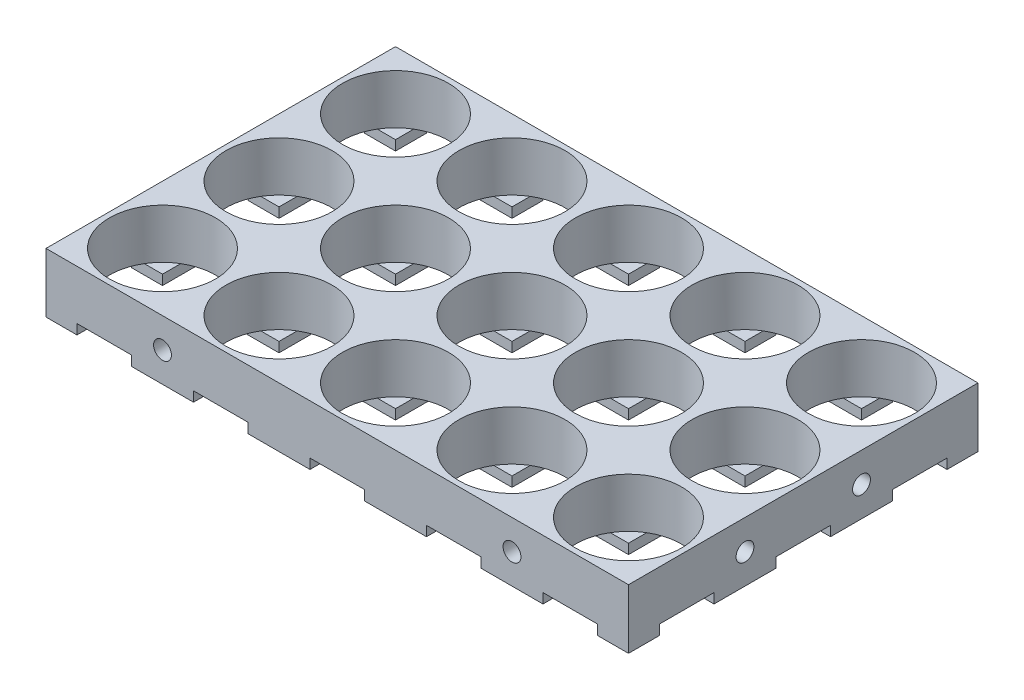
from build123d import *

# Parameters (mm, degrees)
SKETCH1_W           = 23.5
SKETCH1_H           = 23.5
SKETCH1_R           = 10.7
BOSS_EXTRUDE1_DEPTH = 10
SKETCH4_W           = 6.25
SKETCH4_H           = 6.25
BOSS_EXTRUDE2_DEPTH = 2
LPATTERN2_COUNT     = 5
LPATTERN2_PITCH     = 23.5
LPATTERN2_2_COUNT   = 3
LPATTERN2_2_PITCH   = 23.5
SKETCH6_R           = 1.8
CUT_EXTRUDE1_DEPTH  = 6
SKETCH7_R           = 1.8
CUT_EXTRUDE2_DEPTH  = 6
SKETCH8_R           = 1.8
CUT_EXTRUDE3_DEPTH  = 6
SKETCH9_R           = 1.8
CUT_EXTRUDE4_DEPTH  = 6


with BuildPart() as part:
    # Sketch1 → Boss-Extrude1 (new body)
    with BuildSketch(Plane(origin=(0, 0, 0), x_dir=(1, 0, 0), z_dir=(0, 1, 0))):
        Rectangle(SKETCH1_W, SKETCH1_H)
        Circle(SKETCH1_R, mode=Mode.SUBTRACT)
    extrude(amount=BOSS_EXTRUDE1_DEPTH)

    # Sketch4 → Boss-Extrude2 (add)
    with BuildSketch(Plane.XZ):
        with Locations((-8.625, 8.625)):
            Rectangle(SKETCH4_W, SKETCH4_H)
        with Locations((8.625, 8.625)):
            Rectangle(SKETCH4_W, SKETCH4_H)
        with Locations((8.625, -8.625)):
            Rectangle(SKETCH4_W, SKETCH4_H)
        with Locations((-8.625, -8.625)):
            Rectangle(SKETCH4_W, SKETCH4_H)
    extrude(amount=BOSS_EXTRUDE2_DEPTH)


with BuildPart() as lpattern2_1:
    # LPattern2: pattern copy
    add(part.part.moved(Location(Vector(1, 0, 0) * (1 * LPATTERN2_PITCH))))


with BuildPart() as lpattern2_2:
    # LPattern2: pattern copy
    add(part.part.moved(Location(Vector(1, 0, 0) * (2 * LPATTERN2_PITCH))))


with BuildPart() as lpattern2_3:
    # LPattern2: pattern copy
    add(part.part.moved(Location(Vector(1, 0, 0) * (3 * LPATTERN2_PITCH))))


with BuildPart() as lpattern2_4:
    # LPattern2: pattern copy
    add(part.part.moved(Location(Vector(1, 0, 0) * (4 * LPATTERN2_PITCH))))


with BuildPart() as lpattern2_2_1:
    # LPattern2 2: pattern copy
    add(part.part.moved(Location(Vector(0, 0, 1) * (1 * LPATTERN2_2_PITCH))))


with BuildPart() as lpattern2_2_2:
    # LPattern2 2: pattern copy
    add(part.part.moved(Location(Vector(0, 0, 1) * (2 * LPATTERN2_2_PITCH))))


with BuildPart() as lpattern2_2_3:
    # LPattern2 2: pattern copy
    add(lpattern2_1.part.moved(Location(Vector(0, 0, 1) * (1 * LPATTERN2_2_PITCH))))


with BuildPart() as lpattern2_2_4:
    # LPattern2 2: pattern copy
    add(lpattern2_1.part.moved(Location(Vector(0, 0, 1) * (2 * LPATTERN2_2_PITCH))))


with BuildPart() as lpattern2_2_5:
    # LPattern2 2: pattern copy
    add(lpattern2_2.part.moved(Location(Vector(0, 0, 1) * (1 * LPATTERN2_2_PITCH))))


with BuildPart() as lpattern2_2_6:
    # LPattern2 2: pattern copy
    add(lpattern2_2.part.moved(Location(Vector(0, 0, 1) * (2 * LPATTERN2_2_PITCH))))


with BuildPart() as lpattern2_2_7:
    # LPattern2 2: pattern copy
    add(lpattern2_3.part.moved(Location(Vector(0, 0, 1) * (1 * LPATTERN2_2_PITCH))))


with BuildPart() as lpattern2_2_8:
    # LPattern2 2: pattern copy
    add(lpattern2_3.part.moved(Location(Vector(0, 0, 1) * (2 * LPATTERN2_2_PITCH))))


with BuildPart() as lpattern2_2_9:
    # LPattern2 2: pattern copy
    add(lpattern2_4.part.moved(Location(Vector(0, 0, 1) * (1 * LPATTERN2_2_PITCH))))


with BuildPart() as lpattern2_2_10:
    # LPattern2 2: pattern copy
    add(lpattern2_4.part.moved(Location(Vector(0, 0, 1) * (2 * LPATTERN2_2_PITCH))))


with BuildPart() as lpattern2_1_1:
    add(lpattern2_1.part)

    # Combine2: union LPattern2_2, LPattern2_3, LPattern2_4, LPattern2 2_9, LPattern2 2_7, LPattern2 2_5, LPattern2 2_3, LPattern2 2_1, LPattern2 2_2, LPattern2 2_4, LPattern2 2_6, LPattern2 2_8, LPattern2 2_10, part
    add(lpattern2_2.part)
    add(lpattern2_3.part)
    add(lpattern2_4.part)
    add(lpattern2_2_9.part)
    add(lpattern2_2_7.part)
    add(lpattern2_2_5.part)
    add(lpattern2_2_3.part)
    add(lpattern2_2_1.part)
    add(lpattern2_2_2.part)
    add(lpattern2_2_4.part)
    add(lpattern2_2_6.part)
    add(lpattern2_2_8.part)
    add(lpattern2_2_10.part)
    add(part.part)

    # Sketch6 → Cut-Extrude1 (cut)
    with BuildSketch(Plane.ZY.offset(11.75)):
        with Locations((11.75, 4)):
            Circle(SKETCH6_R)
        with Locations((35.25, 4)):
            Circle(SKETCH6_R)
    extrude(amount=-CUT_EXTRUDE1_DEPTH, mode=Mode.SUBTRACT)

    # Sketch7 → Cut-Extrude2 (cut)
    with BuildSketch(Plane(origin=(0, 0, -11.75), x_dir=(-1, 0, 0), z_dir=(0, 0, -1))):
        with Locations((-82.25, 4)):
            Circle(SKETCH7_R)
        with Locations((-11.75, 4)):
            Circle(SKETCH7_R)
    extrude(amount=-CUT_EXTRUDE2_DEPTH, mode=Mode.SUBTRACT)

    # Sketch8 → Cut-Extrude3 (cut)
    with BuildSketch(Plane(origin=(105.75, 0, 0), x_dir=(0, 0, -1), z_dir=(1, 0, 0))):
        with Locations((-35.25, 4)):
            Circle(SKETCH8_R)
        with Locations((-11.75, 4)):
            Circle(SKETCH8_R)
    extrude(amount=-CUT_EXTRUDE3_DEPTH, mode=Mode.SUBTRACT)

    # Sketch9 → Cut-Extrude4 (cut)
    with BuildSketch(Plane.XY.offset(58.75)):
        with Locations((11.75, 4)):
            Circle(SKETCH9_R)
        with Locations((82.25, 4)):
            Circle(SKETCH9_R)
    extrude(amount=-CUT_EXTRUDE4_DEPTH, mode=Mode.SUBTRACT)


solid = lpattern2_1_1.part
